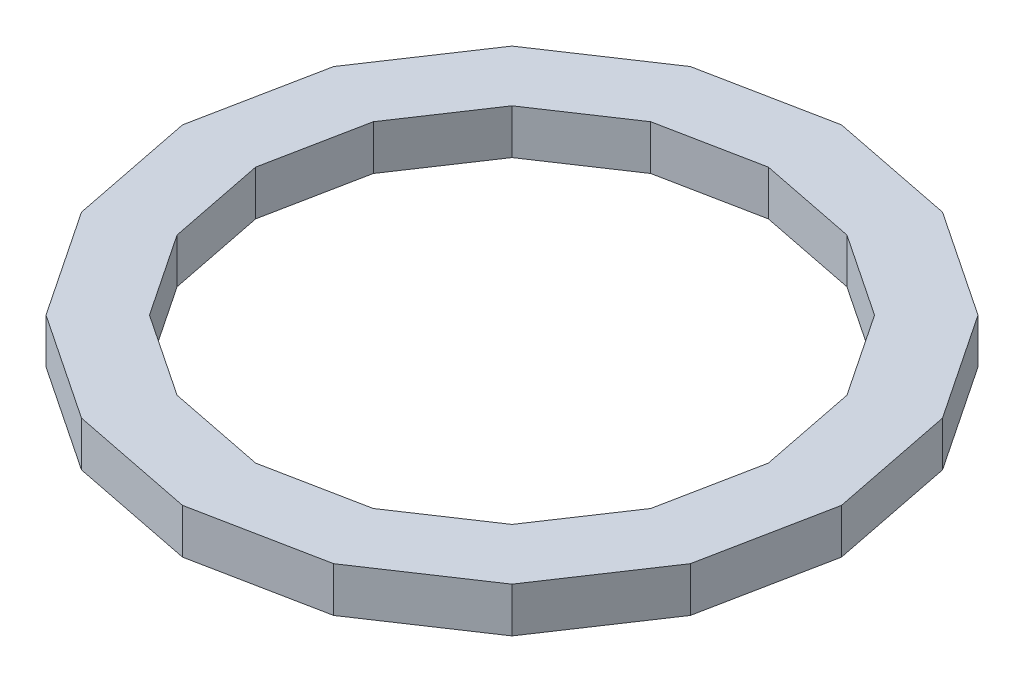
from build123d import *

# Parameters (mm, degrees)
BOSS_EXTRUDE1_DEPTH = 19.05


with BuildPart() as part:
    # Sketch1 → Boss-Extrude1 (new body)
    with BuildSketch(Plane(origin=(0, 0, 0), x_dir=(1, 0, 0), z_dir=(0, 1, 0))):
        Polygon((139.960812601, 0), (129.306930116, 53.560684163), (98.967239691, 98.967239691), (53.560684163, 129.306930116), (0, 139.960812601), (-53.560684163, 129.306930116), (-98.967239691, 98.967239691), (-129.306930116, 53.560684163), (-139.960812601, 0), (-129.306930116, -53.560684163), (-98.967239691, -98.967239691), (-53.560684163, -129.306930116), (0, -139.960812601), (53.560684163, -129.306930116), (98.967239691, -98.967239691), (129.306930116, -53.560684163), align=None)
        Polygon((108.883674099, 0), (100.595397925, 41.667978133), (76.992384316, 76.992384316), (41.667978133, 100.595397925), (0, 108.883674099), (-41.667978133, 100.595397925), (-76.992384316, 76.992384316), (-100.595397925, 41.667978133), (-108.883674099, 0), (-100.595397925, -41.667978133), (-76.992384316, -76.992384316), (-41.667978133, -100.595397925), (0, -108.883674099), (41.667978133, -100.595397925), (76.992384316, -76.992384316), (100.595397925, -41.667978133), align=None, mode=Mode.SUBTRACT)
    extrude(amount=BOSS_EXTRUDE1_DEPTH)


solid = part.part
